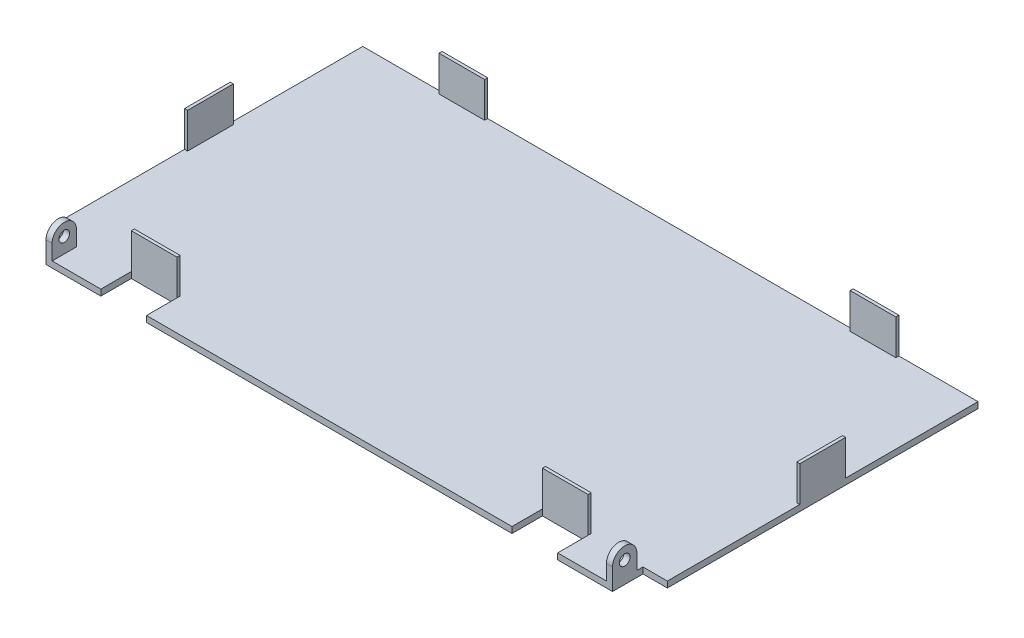
from build123d import *

# Parameters (mm, degrees)
SKETCH1_W           = 202
SKETCH1_H           = 102
BOSS_EXTRUDE1_DEPTH = 2
SKETCH2_W           = 15
SKETCH2_H           = 1
SKETCH2_W_2         = 1
SKETCH2_H_2         = 15
BOSS_EXTRUDE2_DEPTH = 11.6
SKETCH3_W           = 202
SKETCH3_H           = 2
BOSS_EXTRUDE3_DEPTH = 10
SKETCH10_W          = 10
SKETCH10_H          = 2
CUT_EXTRUDE1_DEPTH  = 8
SKETCH12_R          = 1.75
BOSS_EXTRUDE5_DEPTH = 2
SKETCH13_W          = 15
SKETCH13_H          = 10
CUT_EXTRUDE2_DEPTH  = 119.560364372


with BuildPart() as part:
    # Sketch1 → Boss-Extrude1 (new body)
    with BuildSketch(Plane(origin=(0, 0, 0), x_dir=(1, 0, 0), z_dir=(0, 1, 0))):
        Rectangle(SKETCH1_W, SKETCH1_H)
    extrude(amount=BOSS_EXTRUDE1_DEPTH)

    # Sketch2 → Boss-Extrude2 (add)
    with BuildSketch(Plane(origin=(0, 2, 0), x_dir=(1, 0, 0), z_dir=(0, 1, 0))):
        with Locations((-67.5, 50.5)):
            Rectangle(SKETCH2_W, SKETCH2_H)
        with Locations((-67.5, -50.5)):
            Rectangle(SKETCH2_W, SKETCH2_H)
        with Locations((67.5, -50.5)):
            Rectangle(SKETCH2_W, SKETCH2_H)
        with Locations((67.5, 50.5)):
            Rectangle(SKETCH2_W, SKETCH2_H)
        with Locations((100.5, 0)):
            Rectangle(SKETCH2_W_2, SKETCH2_H_2)
        with Locations((-100.5, 0)):
            Rectangle(SKETCH2_W_2, SKETCH2_H_2)
    extrude(amount=BOSS_EXTRUDE2_DEPTH)

    # Sketch3 → Boss-Extrude3 (add)
    with BuildSketch(Plane.XY.offset(51)):
        with Locations((0, 1)):
            Rectangle(SKETCH3_W, SKETCH3_H)
    extrude(amount=BOSS_EXTRUDE3_DEPTH)

    # Sketch10 → Cut-Extrude1 (cut)
    with BuildSketch(Plane.ZY.offset(101)):
        with Locations((56, 1)):
            Rectangle(SKETCH10_W, SKETCH10_H)
    cut_extrude1 = extrude(amount=-CUT_EXTRUDE1_DEPTH, mode=Mode.SUBTRACT)

    # Mirror3: Cut-Extrude1 across plane
    add(cut_extrude1.mirror(Plane.ZY), mode=Mode.SUBTRACT)

    # Sketch12 → Boss-Extrude5 (add)
    with BuildSketch(Plane.ZY.offset(93)):
        with BuildLine():
            Line((61, 2), (61, 7))
            ThreePointArc((61, 7), (57, 11), (53, 7))
            Line((53, 7), (53, 2))
            Line((53, 2), (61, 2))
        make_face()
        with Locations((57, 7)):
            Circle(SKETCH12_R, mode=Mode.SUBTRACT)
    boss_extrude5 = extrude(amount=-BOSS_EXTRUDE5_DEPTH)

    # Mirror4: Boss-Extrude5 across plane
    add(boss_extrude5.mirror(Plane.ZY))

    # Sketch13 → Cut-Extrude2 (cut, through all)
    with BuildSketch(Plane(origin=(0, 2, 0), x_dir=(1, 0, 0), z_dir=(0, 1, 0))):
        with Locations((-67.5, -56)):
            Rectangle(SKETCH13_W, SKETCH13_H)
        with Locations((67.5, -56)):
            Rectangle(SKETCH13_W, SKETCH13_H)
    extrude(amount=-CUT_EXTRUDE2_DEPTH, mode=Mode.SUBTRACT)


solid = part.part
